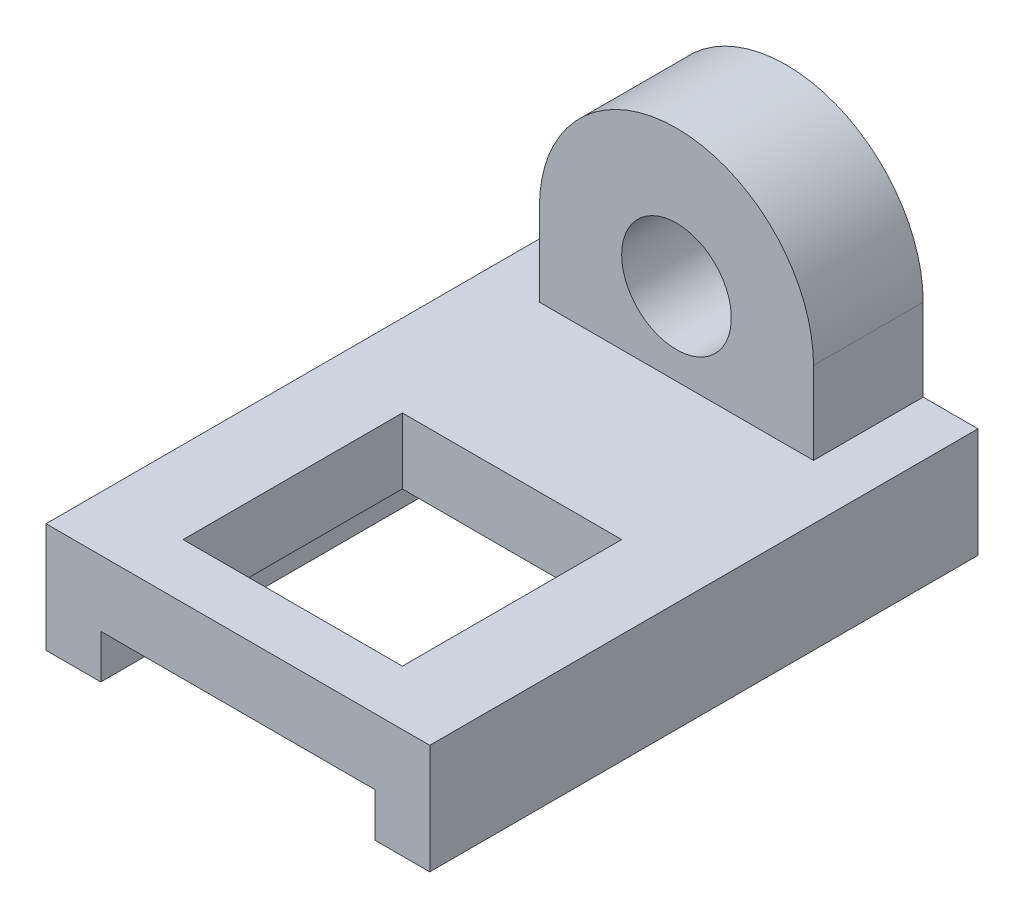
from build123d import *

# Parameters (mm, degrees)
EXTRUDE_1_DEPTH     = 100
SKETCH_3_R          = 10
EXTRUDE_2_DEPTH     = 20
SKETCH_4_W          = 40
SKETCH_4_H          = 40
CUT_EXTRUDE_1_DEPTH = 12


with BuildPart() as part:
    # Эскиз1 → Бобышка-Вытянуть1 (new body)
    with BuildSketch(Plane.XY):
        Polygon((0, 0), (0, 20), (70, 20), (70, 0), (60, 0), (60, 8), (10, 8), (10, 0), align=None)
    extrude(amount=EXTRUDE_1_DEPTH)

    # Эскиз3 → Бобышка-Вытянуть2 (add)
    with BuildSketch(Plane(origin=(0, 0, 0), x_dir=(-1, 0, 0), z_dir=(0, 0, -1))):
        with BuildLine():
            Line((-60, 20), (-60, 35))
            ThreePointArc((-60, 35), (-35, 60), (-10, 35))
            Line((-10, 35), (-10, 20))
            Line((-10, 20), (-60, 20))
        make_face()
        with Locations((-35, 35)):
            Circle(SKETCH_3_R, mode=Mode.SUBTRACT)
    extrude(amount=-EXTRUDE_2_DEPTH)

    # Эскиз4 → Вырез-Вытянуть1 (cut)
    with BuildSketch(Plane(origin=(0, 20, 0), x_dir=(1, 0, 0), z_dir=(0, 1, 0))):
        with Locations((35, -70)):
            Rectangle(SKETCH_4_W, SKETCH_4_H)
    extrude(amount=-CUT_EXTRUDE_1_DEPTH, mode=Mode.SUBTRACT)


solid = part.part
